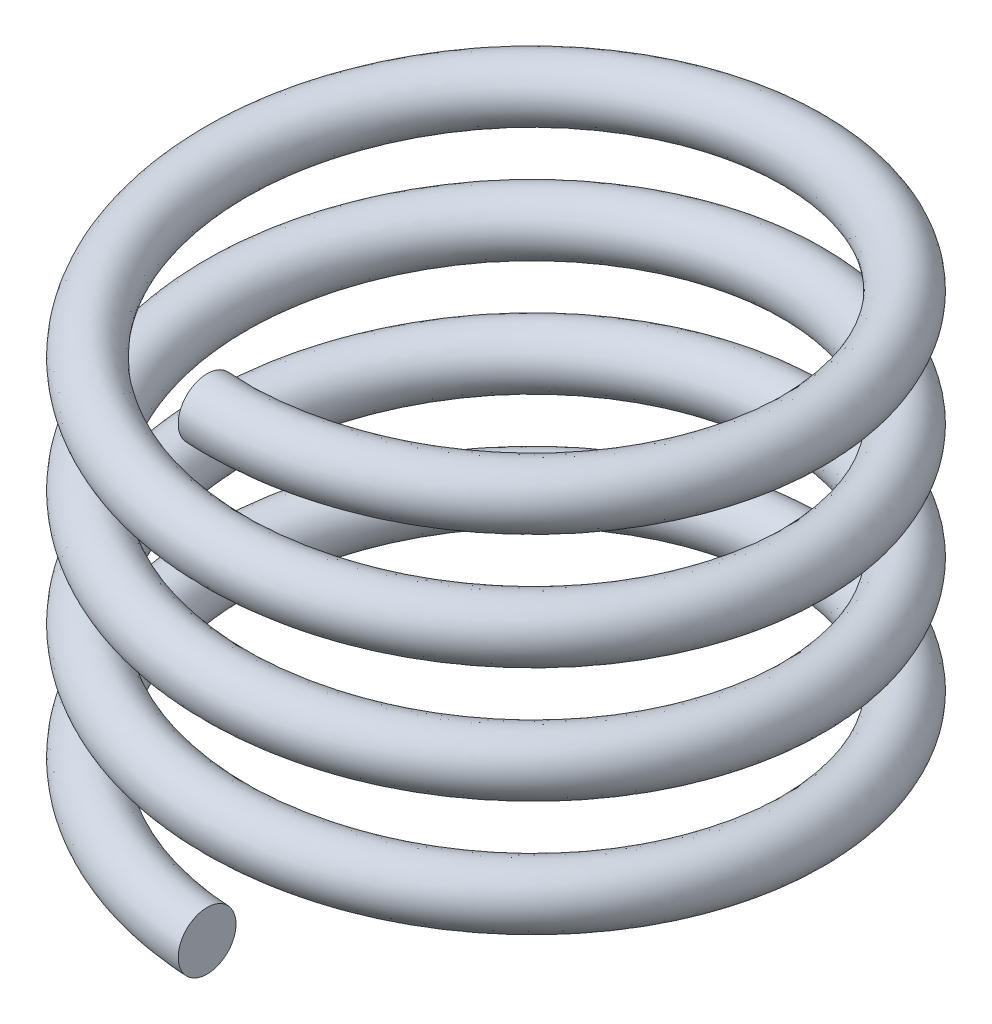
from build123d import *

# Parameters (mm, degrees)
SWEEP1_PITCH  = 2.54
SWEEP1_HEIGHT = 10.16
SWEEP1_RADIUS = 6.35
SKETCH3_R     = 0.635


with BuildPart() as part:
    # Sweep1: sweep along a helix
    with BuildLine() as sweep1_path:
        Helix(SWEEP1_PITCH, SWEEP1_HEIGHT, SWEEP1_RADIUS, center=(0, 0, 0), direction=(0, 1, 0), lefthand=True)
    # Sketch3 → Sweep1 (sweep)
    with BuildSketch(Plane(origin=(0, 0, 0), x_dir=(0, 0, -1), z_dir=(1, 0, 0))):
        with Locations((-6.35, 0)):
            Circle(SKETCH3_R)
    sweep(path=sweep1_path.line, is_frenet=True)


solid = part.part
